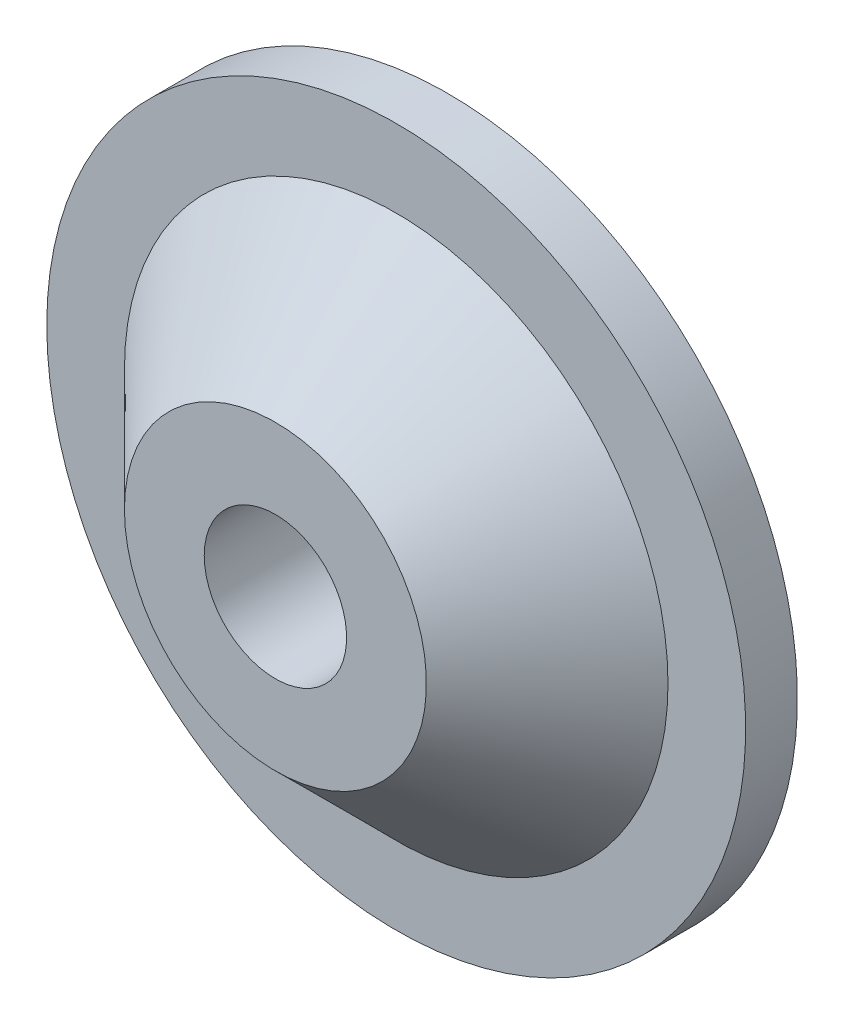
from build123d import *

# Parameters (mm, degrees)
CHAMFER1_SIZE = 0.5


with BuildPart() as part:
    # Sketch3 → Revolve1 (revolve)
    with BuildSketch(Plane(origin=(0, 0, 0), x_dir=(1, 0, 0), z_dir=(0, 1, 0)), mode=Mode.PRIVATE) as revolve1_sk:
        Polygon((6.3, 0), (8.1, 0), (8.1, 1.2), (1.65, 1.2), (1.65, 0), (1.65, -2.8), (3.5, -2.8), align=None)
    revolve(revolve1_sk.sketch.rotate(Axis((0, 0, -35.580076817), (0, 0, 1)), 180), axis=Axis((0, 0, -35.580076817), (0, 0, 1)))

    # Chamfer1
    chamfer1_edges = [part.edges().sort_by_distance(p)[0] for p in [
        (1.65, 0, -1.2),
    ]]
    chamfer(chamfer1_edges, length=CHAMFER1_SIZE)


solid = part.part
